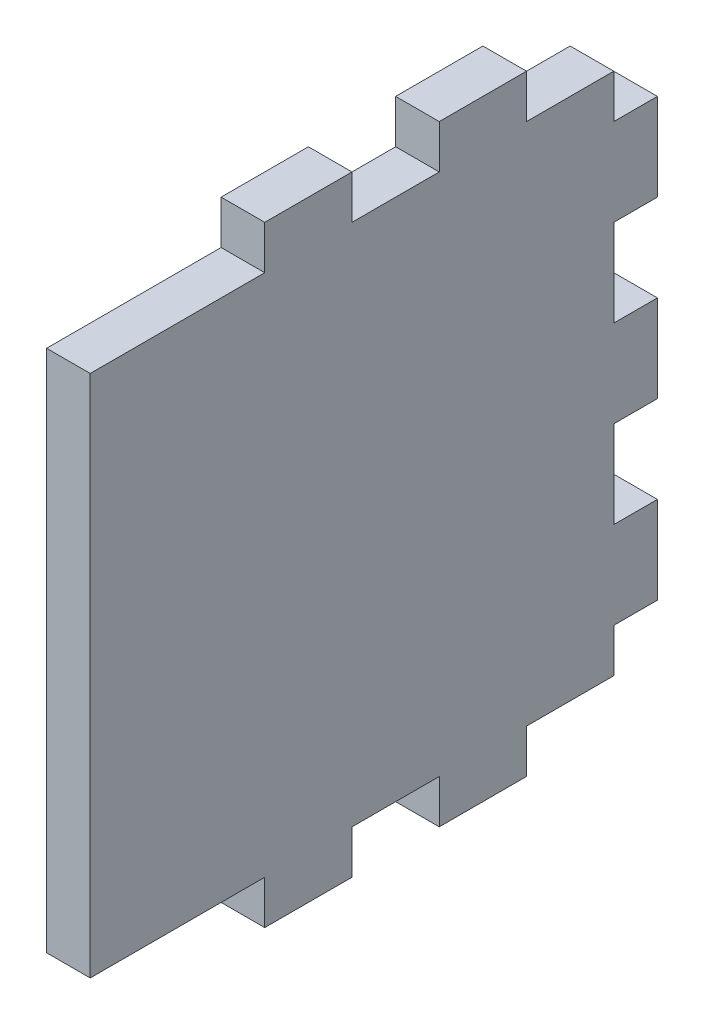
from build123d import *

# Parameters (mm, degrees)
SKETCH1_W           = 88.9
SKETCH1_H           = 82.55
BOSS_EXTRUDE1_DEPTH = 6.35
SKETCH2_W           = 12.7
SKETCH2_H           = 6.35
SKETCH2_W_2         = 6.35
SKETCH2_H_2         = 25.4
SKETCH2_H_3         = 12.7
CUT_EXTRUDE2_DEPTH  = 6.35


with BuildPart() as part:
    # Sketch1 → Boss-Extrude1 (new body)
    with BuildSketch(Plane.YZ):
        with Locations((44.45, 41.275)):
            Rectangle(SKETCH1_W, SKETCH1_H)
    extrude(amount=BOSS_EXTRUDE1_DEPTH)

    # Sketch2 → Cut-Extrude2 (cut)
    with BuildSketch(Plane.YZ.offset(6.35)):
        with Locations((57.15, 3.175)):
            Rectangle(SKETCH2_W, SKETCH2_H)
        with Locations((31.75, 3.175)):
            Rectangle(SKETCH2_W, SKETCH2_H)
        Polygon((0, 0), (12.7, 0), (12.7, 6.35), (6.35, 6.35), (6.35, 19.05), (0, 19.05), (0, 6.35), align=None)
        Polygon((76.2, 0), (88.9, 0), (88.9, 6.35), (88.9, 19.05), (82.55, 19.05), (82.55, 6.35), (76.2, 6.35), align=None)
        with Locations((3.175, 69.85)):
            Rectangle(SKETCH2_W_2, SKETCH2_H_2)
        with Locations((3.175, 38.1)):
            Rectangle(SKETCH2_W_2, SKETCH2_H_3)
        with Locations((85.725, 38.1)):
            Rectangle(SKETCH2_W_2, SKETCH2_H_3)
        with Locations((85.725, 69.85)):
            Rectangle(SKETCH2_W_2, SKETCH2_H_2)
    extrude(amount=-CUT_EXTRUDE2_DEPTH, mode=Mode.SUBTRACT)


solid = part.part
